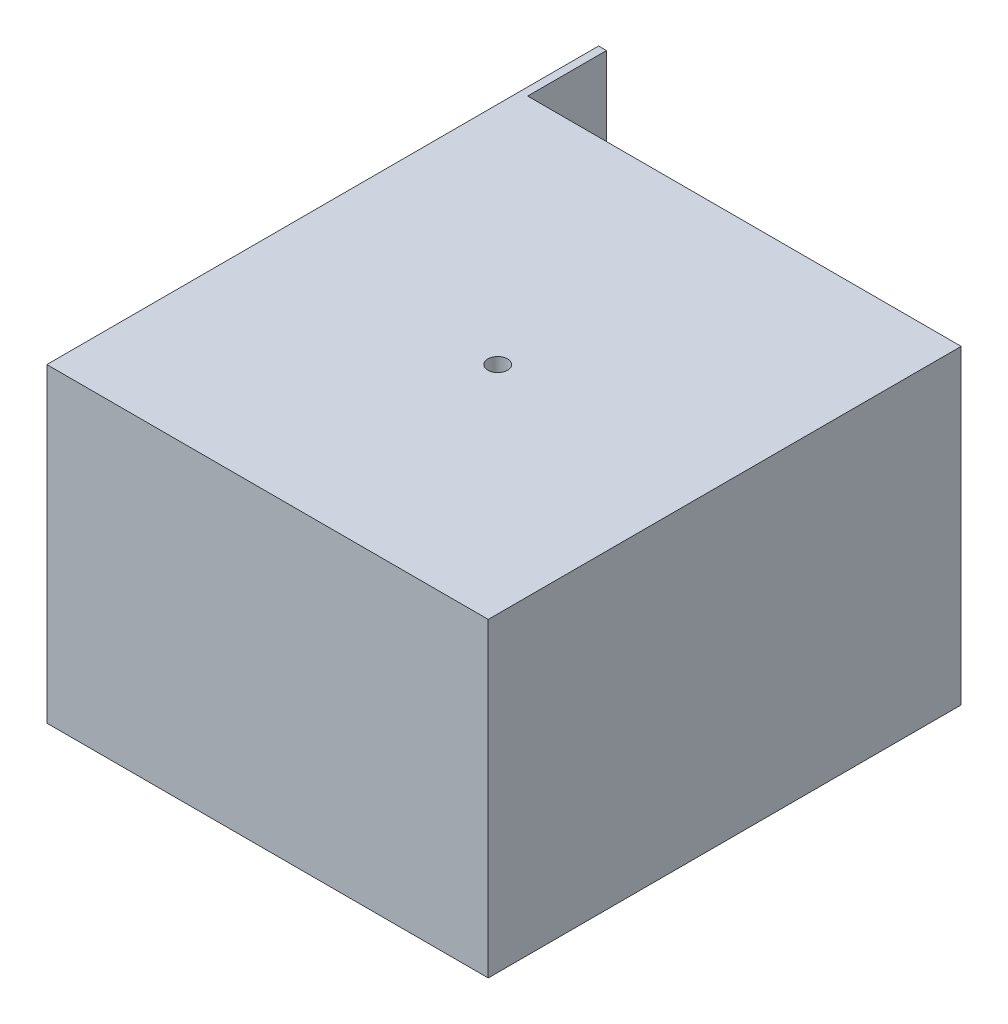
from build123d import *

# Parameters (mm, degrees)
SKETCH1_W           = 71.12
SKETCH1_H           = 76.2
BOSS_EXTRUDE1_DEPTH = 50.038
SKETCH2_W           = 1.27
SKETCH2_H           = 50.038
BOSS_EXTRUDE2_DEPTH = 12.7
SKETCH3_R           = 1.5875
CUT_EXTRUDE1_DEPTH  = 80.680330346


with BuildPart() as part:
    # Sketch1 → Boss-Extrude1 (new body)
    with BuildSketch(Plane(origin=(0, 0, 0), x_dir=(1, 0, 0), z_dir=(0, 1, 0))):
        Rectangle(SKETCH1_W, SKETCH1_H)
    extrude(amount=BOSS_EXTRUDE1_DEPTH)

    # Sketch2 → Boss-Extrude2 (add)
    with BuildSketch(Plane(origin=(0, 0, -38.1), x_dir=(-1, 0, 0), z_dir=(0, 0, -1))):
        with Locations((34.925, 25.019)):
            Rectangle(SKETCH2_W, SKETCH2_H)
    extrude(amount=BOSS_EXTRUDE2_DEPTH)

    # Sketch3 → Cut-Extrude1 (cut, through all)
    with BuildSketch(Plane.XZ):
        with Locations(Location((0.762, 1.778, 0), (0, 0, 270))):
            Circle(SKETCH3_R)
    extrude(amount=-CUT_EXTRUDE1_DEPTH, mode=Mode.SUBTRACT)


solid = part.part
